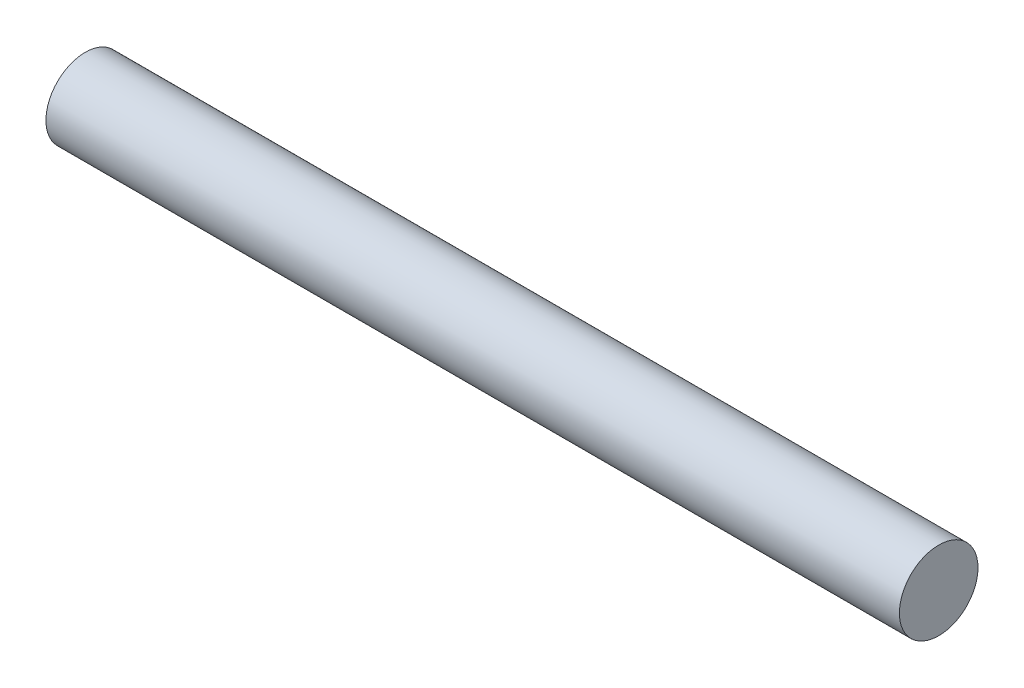
from build123d import *

# Parameters (mm, degrees)
SKETCH12_R = 8.75


with BuildPart() as part:
    # Sweep1: sweep along a path in Sketch1
    with BuildLine(Plane.XY) as sweep1_path:
        Line((0, 0), (190, 0))
    # Sketch12 → Sweep1 (sweep)
    with BuildSketch(Plane(origin=(0, 0, 0), x_dir=(0, 0, -1), z_dir=(1, 0, 0))):
        Circle(SKETCH12_R)
    sweep(path=sweep1_path.line)


solid = part.part
